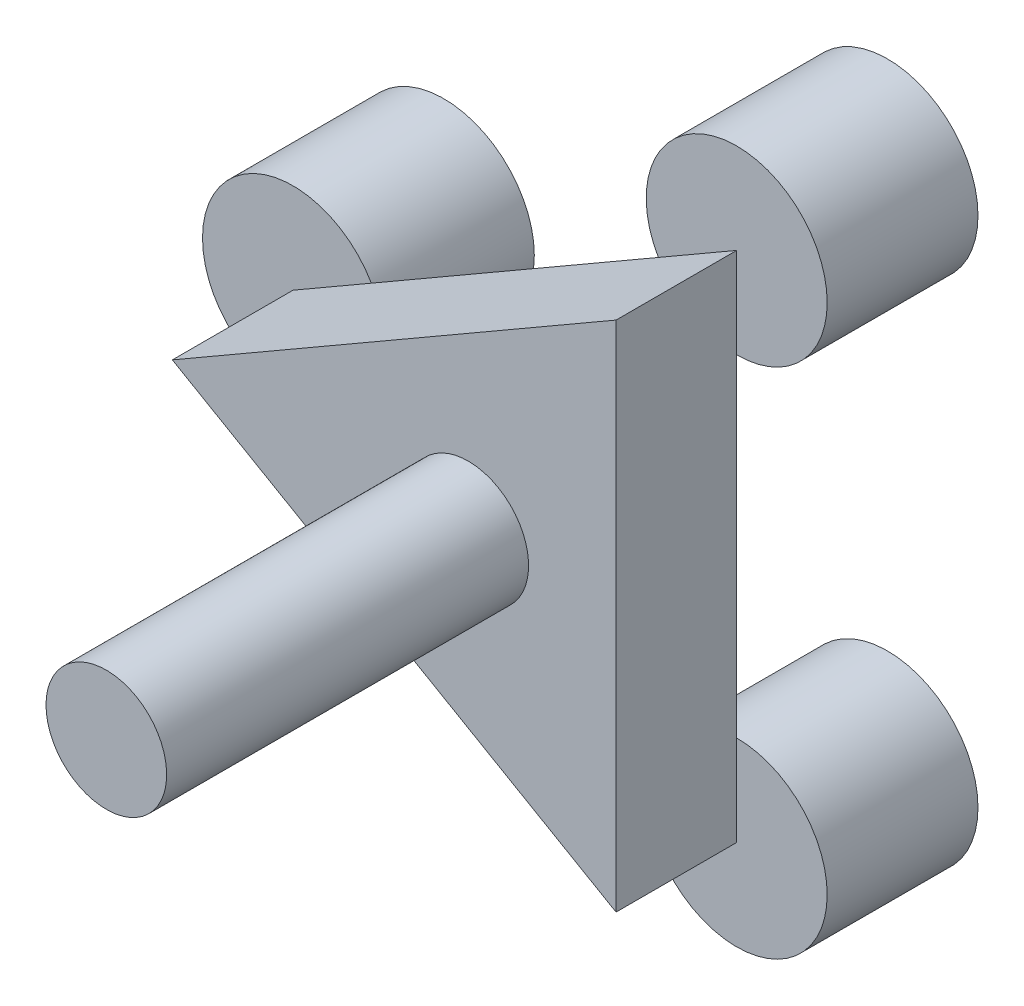
from build123d import *

# Parameters (mm, degrees)
SKETCH1_R             = 19.051661899
BOSS_EXTRUDE3_DEPTH   = 31.75
SKETCH1_R_2           = 19.05
BOSS_EXTRUDE3_2_DEPTH = 31.75
BOSS_EXTRUDE3_3_DEPTH = 31.75
BOSS_EXTRUDE4_DEPTH   = 25.4
SKETCH3_R             = 12.7
BOSS_EXTRUDE5_DEPTH   = 76.2


with BuildPart() as part:
    # Sketch1 → Boss-Extrude3 (new body)
    with BuildSketch(Plane.XY):
        with Locations((-46.704713672, 0.008989394)):
            Circle(SKETCH1_R)
    extrude(amount=-BOSS_EXTRUDE3_DEPTH)



with BuildPart() as body_2:
    # Sketch1 → Boss-Extrude3 2 (new body)
    with BuildSketch(Plane.XY):
        with Locations((46.706375572, -53.972753345)):
            Circle(SKETCH1_R_2)
    extrude(amount=-BOSS_EXTRUDE3_2_DEPTH)


with BuildPart() as body_3:
    # Sketch1 → Boss-Extrude3 3 (new body)
    with BuildSketch(Plane.XY):
        with Locations((46.706375572, 53.972753345)):
            Circle(SKETCH1_R_2)
    extrude(amount=-BOSS_EXTRUDE3_3_DEPTH)


with BuildPart() as part_1:
    add(part.part)

    add(body_2.part)  # Boss-Extrude4 merges body 2

    add(body_3.part)  # Boss-Extrude4 merges body 3
    # Sketch1<6> → Boss-Extrude4 (add)
    with BuildSketch(Plane.XY):
        Polygon((-46.704713672, 0.008989394), (46.706375572, -53.972753345), (46.706375572, 53.972753345), align=None)
    extrude(amount=BOSS_EXTRUDE4_DEPTH)

    # Sketch3 → Boss-Extrude5 (add)
    with BuildSketch(Plane.XY.offset(25.4)):
        with Locations((15.593508684, 0)):
            Circle(SKETCH3_R)
    extrude(amount=BOSS_EXTRUDE5_DEPTH)


solid = part_1.part
